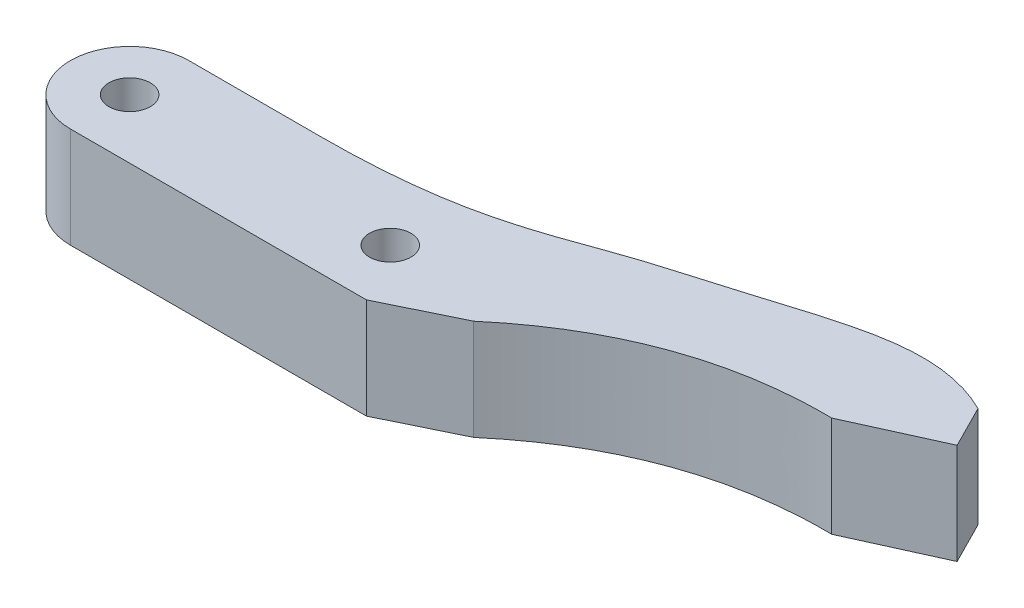
from build123d import *

# Parameters (mm, degrees)
SKETCH2_R           = 5
SKETCH2_R_2         = 1.75
BOSS_EXTRUDE1_DEPTH = 8.5
BOSS_EXTRUDE2_START = -8.5
BOSS_EXTRUDE2_DEPTH = 8.5


with BuildPart() as part:
    # Sketch2 → Boss-Extrude1 (new body)
    # profile 1 of 3: a face of its own
    with BuildSketch(Plane(origin=(0, 0, 0), x_dir=(1, 0, 0), z_dir=(0, 1, 0))):
        with BuildLine():
            ThreePointArc((22, -5), (17, 0), (22, 5))
            Line((22, 5), (2e-09, 5))
            ThreePointArc((2e-09, 5), (3.535533907, 3.535533905), (5, 0))
            ThreePointArc((5, 0), (3.535533908, -3.535533904), (7e-09, -5))
            Line((7e-09, -5), (22, -5))
        make_face()
    # profile 2 of 3: a face of its own
    with BuildSketch(Plane(origin=(0, 0, 0), x_dir=(1, 0, 0), z_dir=(0, 1, 0))):
        Circle(SKETCH2_R)
        with Locations(Location((0, 0, 0), (0, 0, 270))):
            Circle(SKETCH2_R_2, mode=Mode.SUBTRACT)
    # profile 3 of 3: a face of its own
    with BuildSketch(Plane(origin=(0, 0, 0), x_dir=(1, 0, 0), z_dir=(0, 1, 0))):
        with Locations((22, 0)):
            Circle(SKETCH2_R)
        with Locations(Location((22, 0, 0), (0, 0, 270))):
            Circle(SKETCH2_R_2, mode=Mode.SUBTRACT)
    extrude(amount=BOSS_EXTRUDE1_DEPTH)

    # Sketch3 → Boss-Extrude2 (add)
    with BuildSketch(Plane(origin=(0, 8.5, 0), x_dir=(1, 0, 0), z_dir=(0, 1, 0)).offset(BOSS_EXTRUDE2_START)):
        with BuildLine():
            Line((22, -5), (24.99, -5))
            Line((24.99, -5), (31.08, -2.029708536))
            add(Edge.make_bspline(
                [(31.08, -2.029708536), (40.738723452, 6.188270814), (53.27, 6)],
                knots=[0, 0, 0, 1, 1, 1], degree=2))
            Line((53.27, 6), (60.557013712, 9.301428655))
            Line((60.557013712, 9.301428655), (58.75, 12.87))
            add(Edge.make_bspline(
                [(11, 5), (23.320985194, 5), (28.960367737, 8.21999158), (46.060199439, 12.976683932), (52.533262276, 15.918311154), (58.75, 12.87)],
                knots=[0, 0, 0, 0, 0.362024874, 0.462024874, 1, 1, 1, 1], degree=3))
            Line((11, 5), (22, 5))
            ThreePointArc((22, 5), (27, 0), (22, -5))
        make_face()
    extrude(amount=BOSS_EXTRUDE2_DEPTH)


solid = part.part
